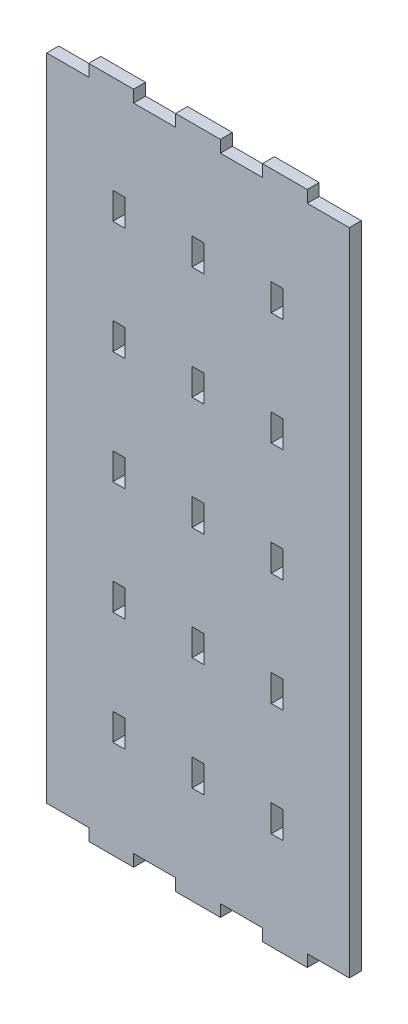
from build123d import *

# Parameters (mm, degrees)
MODEL_W             = 5.350001156
MODEL_H             = 12.000001967
MODEL_H_2           = 11.999994516
MODEL_H_3           = 11.999994517
MODEL_W_2           = 5.349993705
MODEL_W_3           = 5.349993706
BOSS_EXTRUDE1_DEPTH = 5.35


with BuildPart() as part:
    # Model → Boss-Extrude1 (new body)
    with BuildSketch(Plane.XY):
        Polygon((0, 295.349996537), (0, 5.349997431), (18.74999702, 5.349997431), (18.74999702, 0), (38.749992847, 0), (38.749992847, 5.349997431), (57.499989867, 5.349997431), (57.499989867, 0), (77.500000596, 0), (77.500000596, 5.349997431), (96.249997616, 5.349997431), (96.249997616, 0), (116.249993444, 0), (116.249993444, 5.349997431), (134.999997914, 5.349997431), (134.999997914, 295.349996537), (116.249993444, 295.349996537), (116.249993444, 300.699990243), (96.249997616, 300.699990243), (96.249997616, 295.349996537), (77.500000596, 295.349996537), (77.500000596, 300.699990243), (57.499989867, 300.699990243), (57.499989867, 295.349996537), (38.749992847, 295.349996537), (38.749992847, 300.699990243), (18.74999702, 300.699990243), (18.74999702, 295.349996537), align=None)
        with Locations((102.849993855, 49.683332444)):
            Rectangle(MODEL_W, MODEL_H, mode=Mode.SUBTRACT)
        with Locations((102.849993855, 100.016664714)):
            Rectangle(MODEL_W, MODEL_H_2, mode=Mode.SUBTRACT)
        with Locations((102.849993855, 150.35000071)):
            Rectangle(MODEL_W, MODEL_H_3, mode=Mode.SUBTRACT)
        with Locations((102.849993855, 200.683336705)):
            Rectangle(MODEL_W, MODEL_H_2, mode=Mode.SUBTRACT)
        with Locations((102.849993855, 251.016672701)):
            Rectangle(MODEL_W, MODEL_H_3, mode=Mode.SUBTRACT)
        with Locations((67.499995232, 251.016672701)):
            Rectangle(MODEL_W_2, MODEL_H_3, mode=Mode.SUBTRACT)
        with Locations((67.499995232, 200.683336705)):
            Rectangle(MODEL_W_2, MODEL_H_2, mode=Mode.SUBTRACT)
        with Locations((67.499995232, 150.35000071)):
            Rectangle(MODEL_W_2, MODEL_H_3, mode=Mode.SUBTRACT)
        with Locations((67.499995232, 100.016664714)):
            Rectangle(MODEL_W_2, MODEL_H_2, mode=Mode.SUBTRACT)
        with Locations((67.499995232, 49.683332444)):
            Rectangle(MODEL_W_2, MODEL_H, mode=Mode.SUBTRACT)
        with Locations((32.150000334, 49.683332444)):
            Rectangle(MODEL_W_3, MODEL_H, mode=Mode.SUBTRACT)
        with Locations((32.150000334, 100.016664714)):
            Rectangle(MODEL_W_3, MODEL_H_2, mode=Mode.SUBTRACT)
        with Locations((32.150000334, 150.35000071)):
            Rectangle(MODEL_W_3, MODEL_H_3, mode=Mode.SUBTRACT)
        with Locations((32.150000334, 200.683336705)):
            Rectangle(MODEL_W_3, MODEL_H_2, mode=Mode.SUBTRACT)
        with Locations((32.150000334, 251.016672701)):
            Rectangle(MODEL_W_3, MODEL_H_3, mode=Mode.SUBTRACT)
    extrude(amount=BOSS_EXTRUDE1_DEPTH)


solid = part.part
